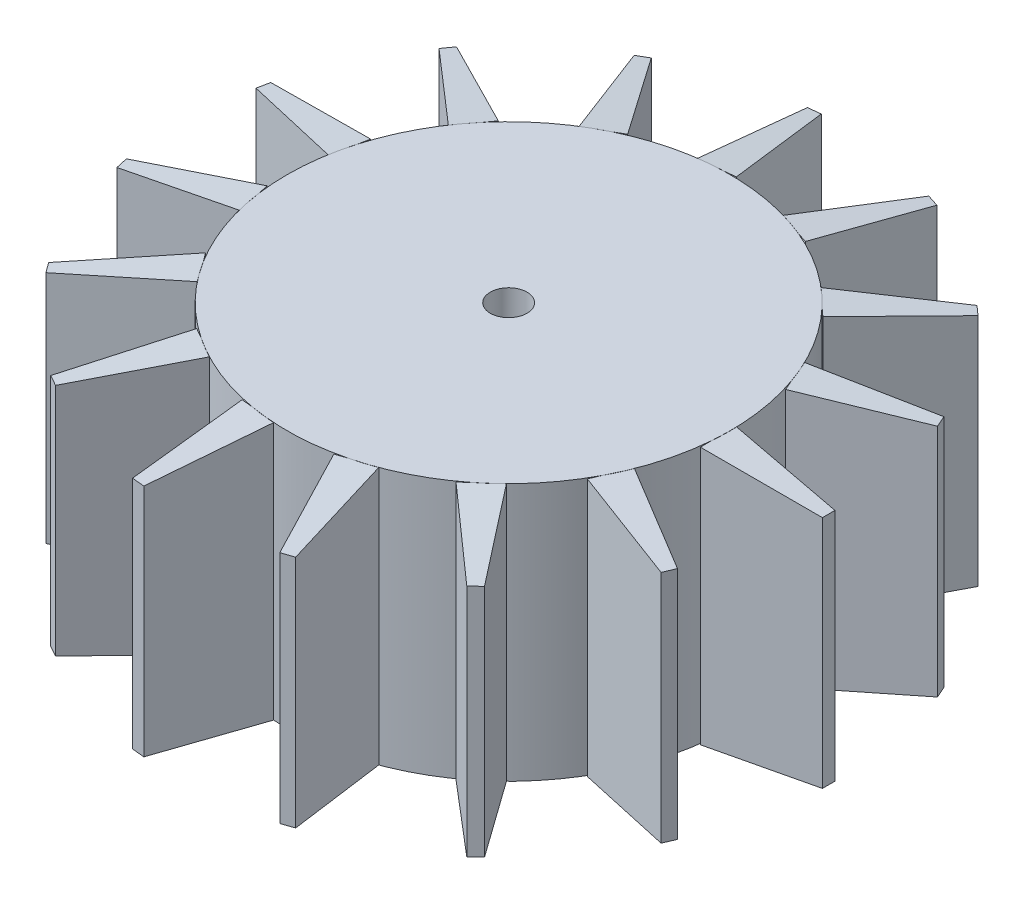
from build123d import *
from build123d.topology import SkipClean

# Parameters (mm, degrees)
SKETCH1_R           = 60.197161107
SKETCH1_R_2         = 40.465282916
BOSS_EXTRUDE1_DEPTH = 70
SKETCH3_W           = 9.709827425
SKETCH3_H           = 70
BOSS_EXTRUDE2_DEPTH = 30
BOSS_EXTRUDE2_TAPER = 6
CIRPATTERN2_COUNT   = 15
CIRPATTERN2_ANGLE   = 337
BOSS_EXTRUDE3_START = -70
SKETCH5_R           = 40.465282916
SKETCH5_R_2         = 4.985284457
BOSS_EXTRUDE3_DEPTH = 70


with BuildPart() as part:
    # Sketch1 → Boss-Extrude1 (new body)
    with BuildSketch(Plane(origin=(0, 0, 0), x_dir=(1, 0, 0), z_dir=(0, 1, 0))):
        with Locations(Location((0, 0, 0), (0, 0, 270))):
            Circle(SKETCH1_R)
        with Locations(Location((0, 0, 0), (0, 0, 270))):
            Circle(SKETCH1_R_2, mode=Mode.SUBTRACT)
    extrude(amount=BOSS_EXTRUDE1_DEPTH)

    # Sketch3 → Boss-Extrude2 (add)
    with SkipClean():  # the faces are left unmerged after this step: merging them gives an invalid solid
        with BuildSketch(Plane(origin=(60, 0, 0), x_dir=(0, 0, -1), z_dir=(1, 0, 0))):
            with Locations((-3.089490545, 35)):
                Rectangle(SKETCH3_W, SKETCH3_H)
        boss_extrude2 = extrude(amount=BOSS_EXTRUDE2_DEPTH, taper=BOSS_EXTRUDE2_TAPER)

    # CirPattern2: Boss-Extrude2 ×15 about axis
    cirpattern2_axis = Axis((0, 0, 0), (0, 1, 0))
    for i in range(1, CIRPATTERN2_COUNT):
        add(boss_extrude2.rotate(cirpattern2_axis, i * CIRPATTERN2_ANGLE / (CIRPATTERN2_COUNT - 1)))

    # Sketch5 → Boss-Extrude3 (add)
    with BuildSketch(Plane(origin=(0, 70, 0), x_dir=(1, 0, 0), z_dir=(0, 1, 0)).offset(BOSS_EXTRUDE3_START)):
        Circle(SKETCH5_R)
        with Locations(Location((0, 0, 0), (0, 0, 270))):
            Circle(SKETCH5_R_2, mode=Mode.SUBTRACT)
    extrude(amount=BOSS_EXTRUDE3_DEPTH)


solid = part.part
